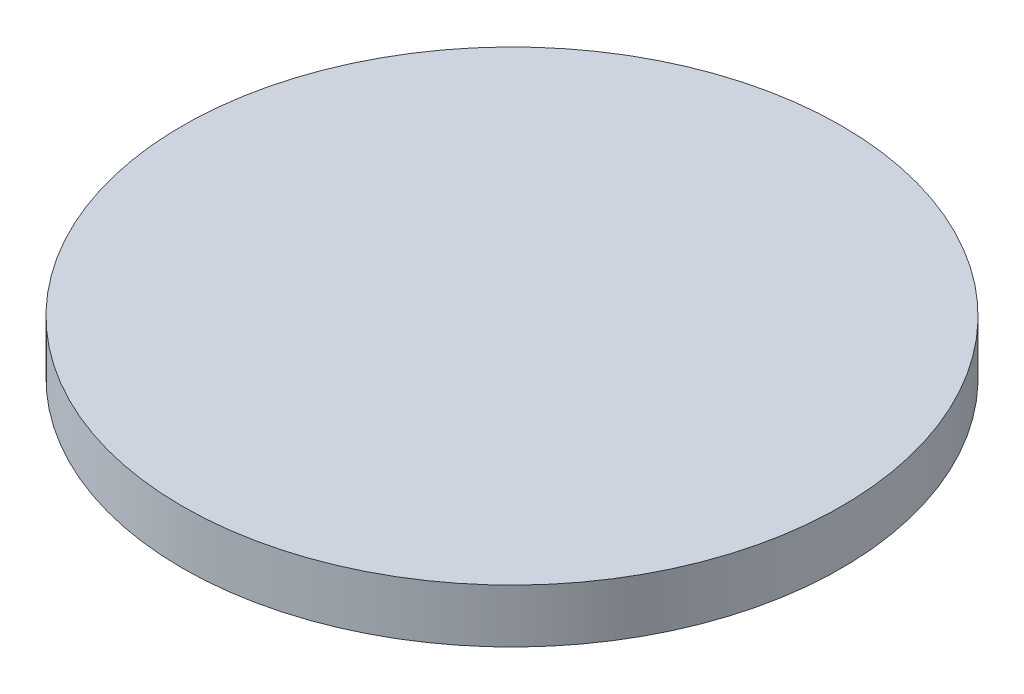
from build123d import *

# Parameters (mm, degrees)
ESQUISSE1_R        = 9.525
BOSS_EXTRU_1_DEPTH = 1.55


with BuildPart() as part:
    # Esquisse1 → Boss.-Extru.1 (new body)
    with BuildSketch(Plane(origin=(0, 0, 0), x_dir=(1, 0, 0), z_dir=(0, 1, 0))):
        with Locations(Location((0, 0, 0), (0, 0, 90))):
            Circle(ESQUISSE1_R)
    extrude(amount=BOSS_EXTRU_1_DEPTH)


solid = part.part
